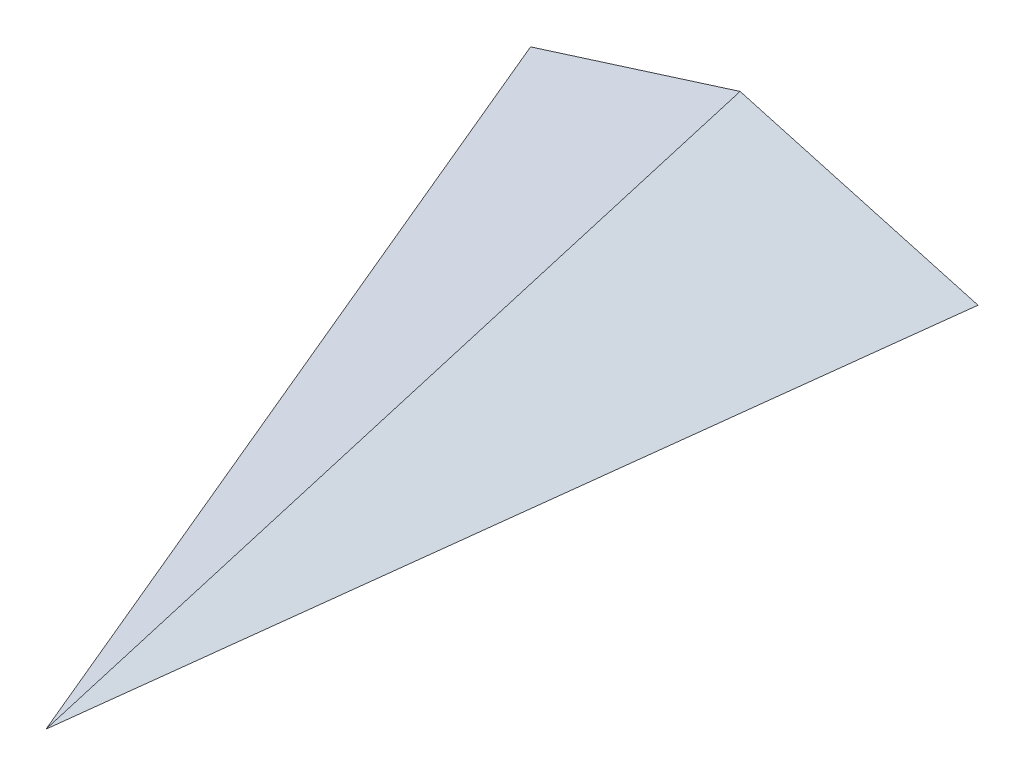
from build123d import *


with BuildPart() as part:
    # Sketch2 → Loft1 section 0
    with BuildSketch(Plane(origin=(0, 0, 0), x_dir=(1, 0, 0), z_dir=(0, 0.9848077530122068, 0.17364817766693802)), mode=Mode.PRIVATE) as loft1_s0:
        with BuildLine():
            Line((0, -109.298856353), (-34, 0))
            Line((-34, 0), (34, 0))
            Line((34, 0), (0, -109.298856353))
        make_face()
    loft([Vertex(0, 12.211616137, 2.153237403), loft1_s0.sketch])


solid = part.part
